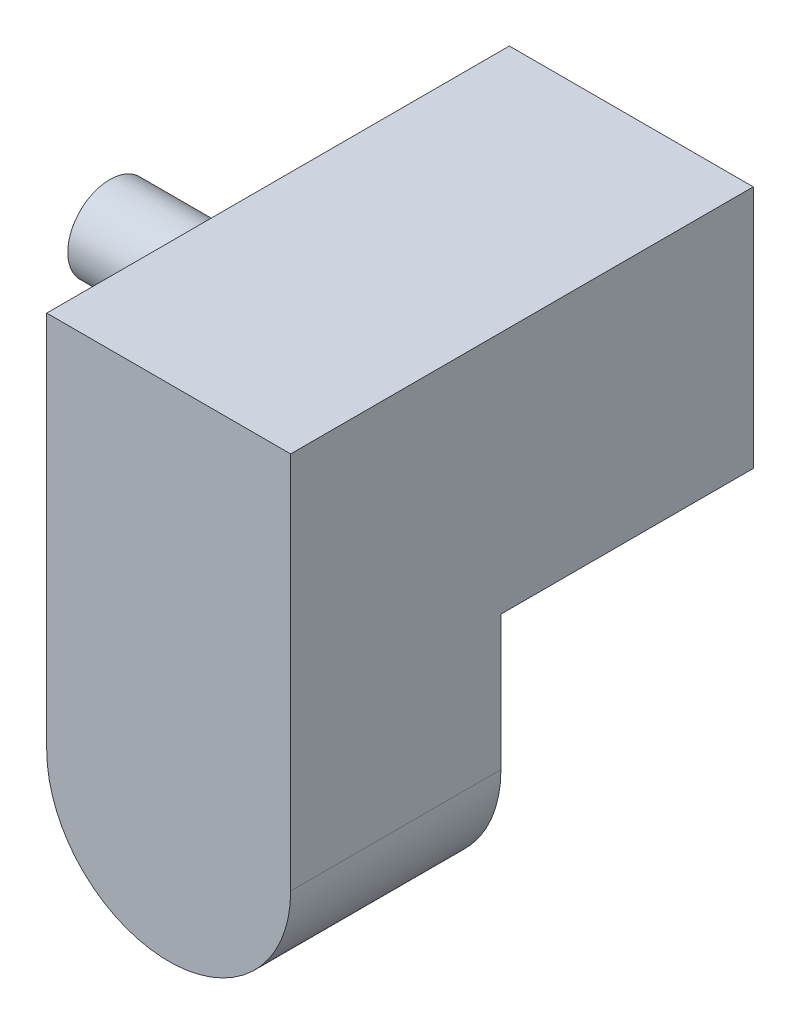
from build123d import *

# Parameters (mm, degrees)
SKETCH1_R           = 36.83
BOSS_EXTRUDE1_DEPTH = 63.5
SKETCH4_W           = 73.66
SKETCH4_H           = 114.3
BOSS_EXTRUDE2_DEPTH = 63.5
SKETCH5_W           = 73.66
SKETCH5_H           = 73.66
BOSS_EXTRUDE3_DEPTH = 76.2
SKETCH6_R           = 12.7
BOSS_EXTRUDE4_DEPTH = 50.8
SKETCH2_R           = 13.97
CUT_EXTRUDE1_DEPTH  = 48.26


with BuildPart() as part:
    # Sketch1 → Boss-Extrude1 (new body)
    with BuildSketch(Plane.XY):
        Circle(SKETCH1_R)
    extrude(amount=BOSS_EXTRUDE1_DEPTH)

    # Sketch4 → Boss-Extrude2 (add, through all)
    with BuildSketch(Plane.XY):
        with Locations((0, 57.15)):
            Rectangle(SKETCH4_W, SKETCH4_H)
    extrude(amount=BOSS_EXTRUDE2_DEPTH)

    # Sketch5 → Boss-Extrude3 (add)
    with BuildSketch(Plane.XY):
        with Locations((0, 77.47)):
            Rectangle(SKETCH5_W, SKETCH5_H)
    extrude(amount=-BOSS_EXTRUDE3_DEPTH)

    # Sketch6 → Boss-Extrude4 (add)
    with BuildSketch(Plane.ZY.offset(36.83)):
        with Locations(Location((-6.35, 76.2, 0), (0, 0, 90))):
            Circle(SKETCH6_R)
    extrude(amount=BOSS_EXTRUDE4_DEPTH)

    # Sketch2 → Cut-Extrude1 (cut)
    with BuildSketch(Plane.XY):
        with Locations(Location((0, 0, 0), (0, 0, 180))):
            Circle(SKETCH2_R)
    extrude(amount=CUT_EXTRUDE1_DEPTH, mode=Mode.SUBTRACT)


solid = part.part
